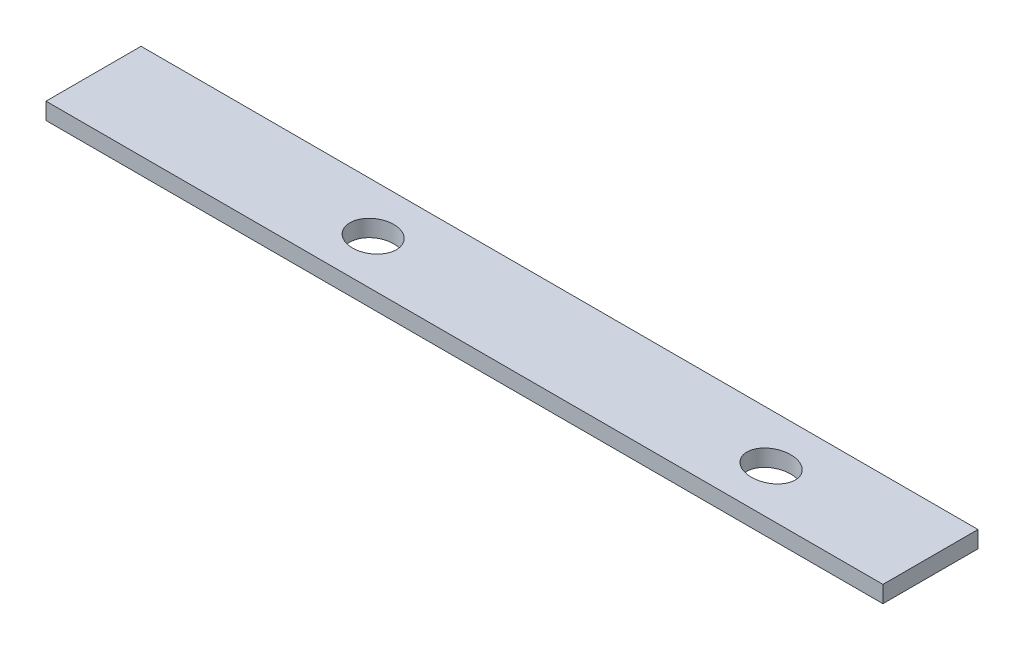
from build123d import *

# Parameters (mm, degrees)
SKETCH1_W           = 44.9
SKETCH1_H           = 5.1
BOSS_EXTRUDE2_DEPTH = 0.9
SKETCH3_RX          = 1.25
SKETCH3_RY          = 1.1
SKETCH3_RX_2        = 1.3
SKETCH3_RY_2        = 1.05
CUT_EXTRUDE4_DEPTH  = 0.9


with BuildPart() as part:
    # Sketch1 → Boss-Extrude2 (new body)
    with BuildSketch(Plane(origin=(0, 0, 0), x_dir=(1, 0, 0), z_dir=(0, 1, 0))):
        with Locations((-2.985779817, -2.55)):
            Rectangle(SKETCH1_W, SKETCH1_H)
    extrude(amount=BOSS_EXTRUDE2_DEPTH)

    # Sketch3 → Cut-Extrude4 (cut)
    with BuildSketch(Plane(origin=(0, 0.9, 0), x_dir=(1, 0, 0), z_dir=(0, 1, 0))):
        with Locations((-10.385779817, -2.6)):
            Ellipse(SKETCH3_RX, SKETCH3_RY)
        with Locations(Location((10.964220183, -2.6), (0, 0, 180))):
            Ellipse(SKETCH3_RX_2, SKETCH3_RY_2)
    extrude(amount=-CUT_EXTRUDE4_DEPTH, mode=Mode.SUBTRACT)


solid = part.part
